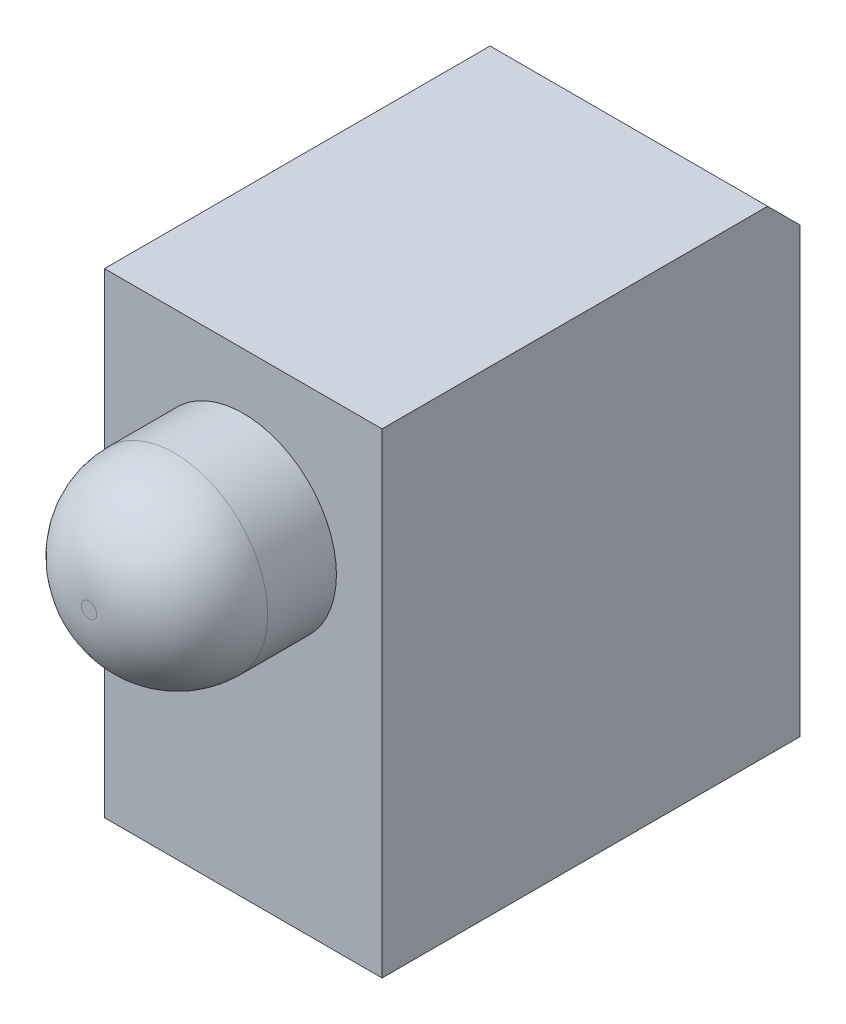
from build123d import *

# Parameters (mm, degrees)
BOSS_EXTRUDE1_DEPTH      = 2.16
BOSS_EXTRUDE1_DEPTH_BACK = 2.16
SKETCH1_W                = 6.5
SKETCH1_H                = 7.4
SKETCH2_R                = 1.45
BOSS_EXTRUDE2_DEPTH      = 2.4
FILLET1_R                = 1.33
CHAMFER1_SIZE            = 0.5


with BuildPart() as part:
    # Sketch1 → Boss-Extrude1 (new, two sides: drawn at the far end of the back side and taken through both)
    with BuildSketch(Plane(origin=(0, 0, 0), x_dir=(0, 0, -1), z_dir=(1, 0, 0)).offset(-BOSS_EXTRUDE1_DEPTH_BACK)):
        Rectangle(SKETCH1_W, SKETCH1_H)
    extrude(amount=BOSS_EXTRUDE1_DEPTH + BOSS_EXTRUDE1_DEPTH_BACK)

    # Sketch2 → Boss-Extrude2 (add)
    with BuildSketch(Plane.XY.offset(3.25)):
        with Locations((0, 1.38)):
            Circle(SKETCH2_R)
    extrude(amount=BOSS_EXTRUDE2_DEPTH)

    # Fillet1
    fillet1_edges = [part.edges().sort_by_distance(p)[0] for p in [
        (-1.45, 1.38, 5.65),
    ]]
    fillet(fillet1_edges, radius=FILLET1_R)

    # Chamfer1
    chamfer1_edges = [part.edges().sort_by_distance(p)[0] for p in [
        (0, 3.7, -3.25),
    ]]
    chamfer(chamfer1_edges, length=CHAMFER1_SIZE)


solid = part.part
